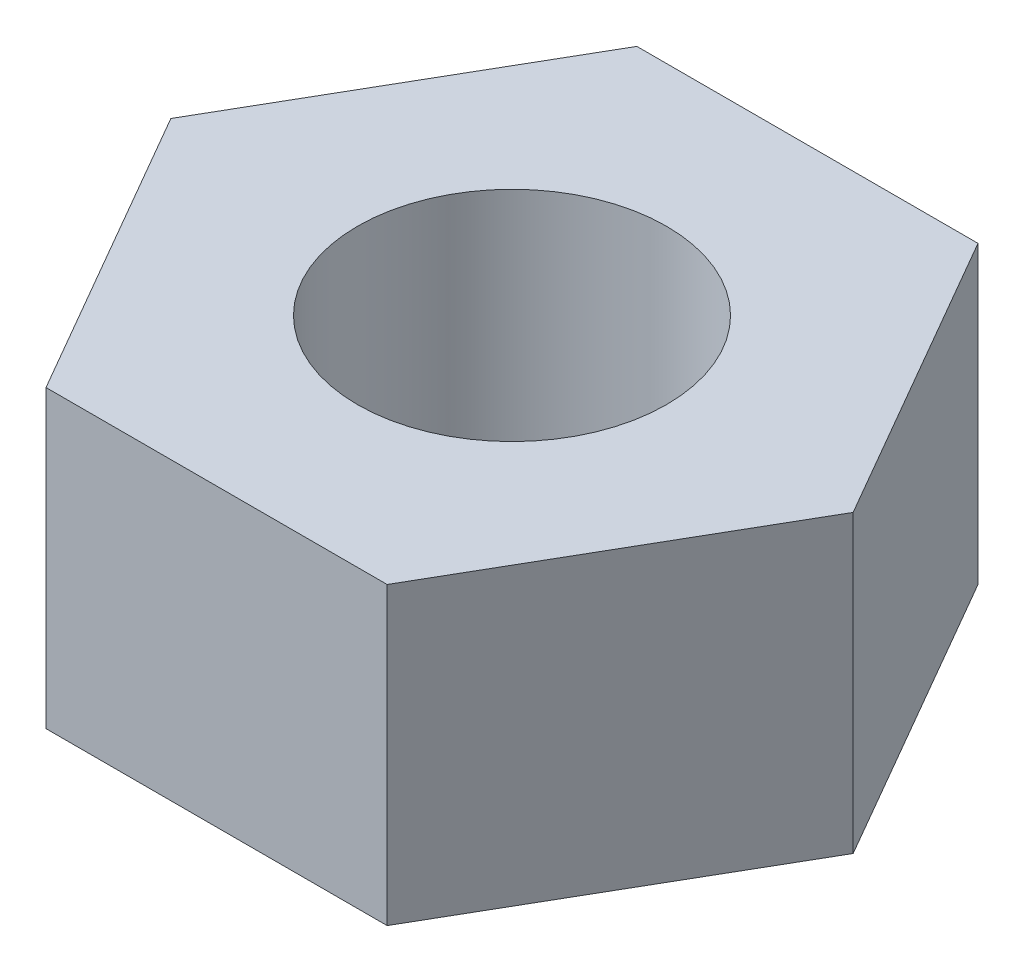
from build123d import *

# Parameters (mm, degrees)
BOSS_EXTRUDE1_DEPTH          = 6.5
TAP_DRILL_FOR_M8X1_25_TAP1_D = 6.8


with BuildPart() as part:
    # Sketch1 → Boss-Extrude1 (new body)
    with BuildSketch(Plane(origin=(0, 0, 0), x_dir=(1, 0, 0), z_dir=(0, 1, 0))):
        Polygon((3.75277675, 6.5), (-3.75277675, 6.5), (-7.505553499, 0), (-3.75277675, -6.5), (3.75277675, -6.5), (7.505553499, 0), align=None)
    extrude(amount=BOSS_EXTRUDE1_DEPTH)

    # Tap Drill for M8x1.25 Tap1 (through all)
    with Locations(Plane(origin=(0, 6.5, 0), x_dir=(1, 0, 0), z_dir=(0, 1, 0))):
        with Locations((0, 0)):
            Hole(TAP_DRILL_FOR_M8X1_25_TAP1_D / 2)


solid = part.part
